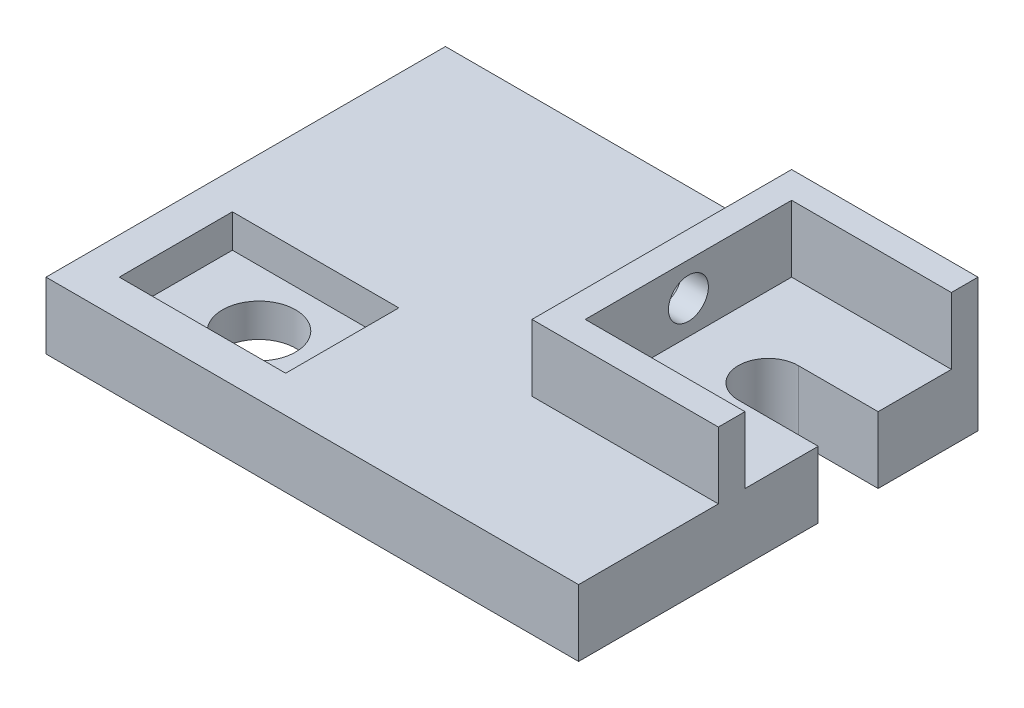
from build123d import *

# Parameters (mm, degrees)
SKETCH_1_W          = 80
SKETCH_1_H          = 60
EXTRUDE_1_DEPTH     = 10
SKETCH_2_R          = 5.5
SKETCH_2_R_2        = 4.5
CUT_EXTRUDE_1_DEPTH = 51.990195136
EXTRUDE_2_DEPTH     = 10
SKETCH_5_R          = 3
CUT_EXTRUDE_3_DEPTH = 67.603303221
SKETCH_6_W          = 25
SKETCH_6_H          = 17
CUT_EXTRUDE_4_DEPTH = 5


with BuildPart() as part:
    # Эскиз1 → Бобышка-Вытянуть1 (new body)
    with BuildSketch(Plane(origin=(0, 0, 0), x_dir=(1, 0, 0), z_dir=(0, 1, 0))):
        Rectangle(SKETCH_1_W, SKETCH_1_H)
    extrude(amount=EXTRUDE_1_DEPTH)

    # Эскиз2 → Вырез-Вытянуть1 (cut, through all)
    with BuildSketch(Plane(origin=(0, 10, 0), x_dir=(1, 0, 0), z_dir=(0, 1, 0))):
        with Locations(Location((-22, -16, 0), (0, 0, 270))):
            Circle(SKETCH_2_R)
        with Locations((28, 10.5)):
            Circle(SKETCH_2_R_2)
        with BuildLine():
            ThreePointArc((32.5, 10.5), (31.181980515, 7.318019485), (28, 6))
            Line((28, 6), (40, 6))
            Line((40, 6), (40, 15))
            Line((40, 15), (28, 15))
            ThreePointArc((28, 15), (31.181980515, 13.681980515), (32.5, 10.5))
        make_face()
    extrude(amount=-CUT_EXTRUDE_1_DEPTH, mode=Mode.SUBTRACT)

    # Эскиз4 → Бобышка-Вытянуть2 (add)
    with BuildSketch(Plane(origin=(0, 10, 0), x_dir=(1, 0, 0), z_dir=(0, 1, 0))):
        Polygon((40, -9), (40, -5), (16, -5), (16, 26), (40, 26), (40, 30), (12, 30), (12, -9), align=None)
    extrude(amount=EXTRUDE_2_DEPTH)

    # Эскиз5 → Вырез-Вытянуть3 (cut, through all)
    with BuildSketch(Plane(origin=(16, 0, 0), x_dir=(0, 0, -1), z_dir=(1, 0, 0))):
        with Locations((10.5, 15)):
            Circle(SKETCH_5_R)
    extrude(amount=-CUT_EXTRUDE_3_DEPTH, mode=Mode.SUBTRACT)

    # Эскиз6 → Вырез-Вытянуть4 (cut)
    with BuildSketch(Plane(origin=(0, 10, 0), x_dir=(1, 0, 0), z_dir=(0, 1, 0))):
        with Locations((-22, -16)):
            Rectangle(SKETCH_6_W, SKETCH_6_H)
    extrude(amount=-CUT_EXTRUDE_4_DEPTH, mode=Mode.SUBTRACT)


solid = part.part
